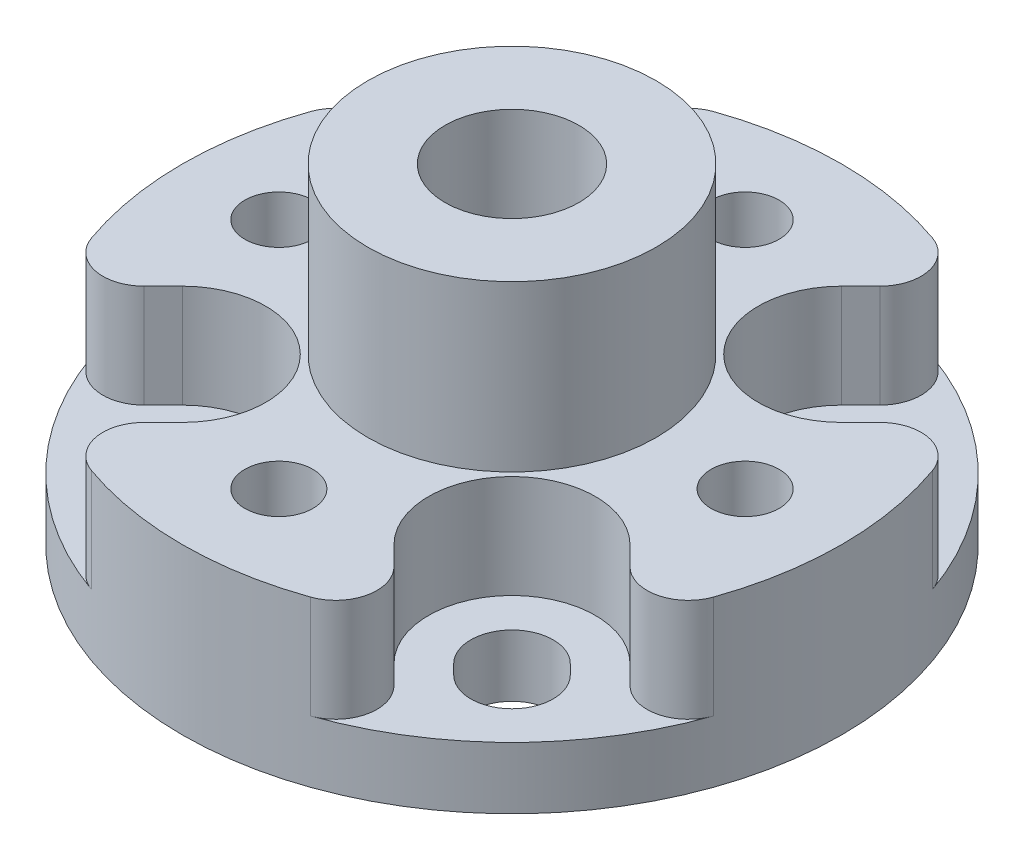
from build123d import *

# Parameters (mm, degrees)
SKETCH1_R           = 16
BOSS_EXTRUDE1_DEPTH = 8
SKETCH2_R           = 7
BOSS_EXTRUDE2_DEPTH = 8
SKETCH3_R           = 3.25
CUT_EXTRUDE1_DEPTH  = 28.712812921
SKETCH4_R           = 1.65
CUT_EXTRUDE2_DEPTH  = 25
CUT_EXTRUDE3_DEPTH  = 25
CUT_EXTRUDE4_START  = -5
CUT_EXTRUDE4_DEPTH  = 5


with BuildPart() as part:
    # Sketch1 → Boss-Extrude1 (new body)
    with BuildSketch(Plane(origin=(0, 0, 0), x_dir=(1, 0, 0), z_dir=(0, 1, 0))):
        with Locations(Location((0, 0, 0), (0, 0, 270))):
            Circle(SKETCH1_R)
    extrude(amount=BOSS_EXTRUDE1_DEPTH)

    # Sketch2 → Boss-Extrude2 (add)
    with BuildSketch(Plane(origin=(0, 8, 0), x_dir=(1, 0, 0), z_dir=(0, 1, 0))):
        with Locations(Location((0, 0, 0), (0, 0, 270))):
            Circle(SKETCH2_R)
    extrude(amount=BOSS_EXTRUDE2_DEPTH)

    # Sketch3 → Cut-Extrude1 (cut, through all)
    with BuildSketch(Plane(origin=(0, 16, 0), x_dir=(1, 0, 0), z_dir=(0, 1, 0))):
        with Locations(Location((0, 0, 0), (0, 0, 270))):
            Circle(SKETCH3_R)
    extrude(amount=-CUT_EXTRUDE1_DEPTH, mode=Mode.SUBTRACT)

    # Sketch4 → Cut-Extrude2 (cut, through all)
    with BuildSketch(Plane(origin=(0, 8, 0), x_dir=(1, 0, 0), z_dir=(0, 1, 0))):
        with Locations(Location((0, 11.313708499, 0), (0, 0, 270))):
            Circle(SKETCH4_R)
        with Locations(Location((-11.313708499, 0, 0), (0, 0, 270))):
            Circle(SKETCH4_R)
        with Locations(Location((0, -11.313708499, 0), (0, 0, 270))):
            Circle(SKETCH4_R)
        with Locations(Location((11.313708499, 0, 0), (0, 0, 270))):
            Circle(SKETCH4_R)
    extrude(amount=-CUT_EXTRUDE2_DEPTH, mode=Mode.SUBTRACT)

    # Sketch5 → Cut-Extrude3 (cut, through all)
    with BuildSketch(Plane(origin=(0, 8, 0), x_dir=(1, 0, 0), z_dir=(0, 1, 0))):
        with BuildLine():
            Line((-9.414213562, 6.585786438), (-9.899494937, 7.071067812))
            ThreePointArc((-9.899494937, 7.071067812), (-9.899494937, 9.899494937), (-7.071067812, 9.899494937))
            Line((-7.071067812, 9.899494937), (-6.585786438, 9.414213562))
            ThreePointArc((-6.585786438, 9.414213562), (-6.585786438, 6.585786438), (-9.414213562, 6.585786438))
        make_face()
        with BuildLine():
            Line((6.585786438, -9.414213562), (7.071067812, -9.899494937))
            ThreePointArc((7.071067812, -9.899494937), (9.899494937, -9.899494937), (9.899494937, -7.071067812))
            Line((9.899494937, -7.071067812), (9.414213562, -6.585786438))
            ThreePointArc((9.414213562, -6.585786438), (6.585786438, -6.585786438), (6.585786438, -9.414213562))
        make_face()
        with BuildLine():
            Line((6.585786438, 9.414213562), (7.071067812, 9.899494937))
            ThreePointArc((7.071067812, 9.899494937), (9.899494937, 9.899494937), (9.899494937, 7.071067812))
            Line((9.899494937, 7.071067812), (9.414213562, 6.585786438))
            ThreePointArc((9.414213562, 6.585786438), (6.585786438, 6.585786438), (6.585786438, 9.414213562))
        make_face()
        with BuildLine():
            Line((-9.414213562, -6.585786438), (-9.899494937, -7.071067812))
            ThreePointArc((-9.899494937, -7.071067812), (-9.899494937, -9.899494937), (-7.071067812, -9.899494937))
            Line((-7.071067812, -9.899494937), (-6.585786438, -9.414213562))
            ThreePointArc((-6.585786438, -9.414213562), (-6.585786438, -6.585786438), (-9.414213562, -6.585786438))
        make_face()
    extrude(amount=-CUT_EXTRUDE3_DEPTH, mode=Mode.SUBTRACT)

    # Sketch6 → Cut-Extrude4 (cut)
    with BuildSketch(Plane(origin=(0, 8, 0), x_dir=(1, 0, 0), z_dir=(0, 1, 0)).offset(CUT_EXTRUDE4_START)):
        with BuildLine():
            Line((-10.863782464, 5.136217536), (-11.791198103, 6.063633176))
            ThreePointArc((-11.791198103, 6.063633176), (-13.648570413, 6.599704291), (-15.091899046, 5.313622415))
            ThreePointArc((-15.091899046, 5.313622415), (-11.313708499, 11.313708499), (-5.313622415, 15.091899046))
            ThreePointArc((-5.313622415, 15.091899046), (-6.599704291, 13.648570413), (-6.063633176, 11.791198103))
            Line((-6.063633176, 11.791198103), (-5.136217536, 10.863782464))
            ThreePointArc((-5.136217536, 10.863782464), (-5.136217536, 5.136217536), (-10.863782464, 5.136217536))
        make_face()
        with BuildLine():
            Line((5.136217536, 10.863782464), (6.063633176, 11.791198103))
            ThreePointArc((6.063633176, 11.791198103), (6.599704291, 13.648570413), (5.313622415, 15.091899046))
            ThreePointArc((5.313622415, 15.091899046), (11.313708499, 11.313708499), (15.091899046, 5.313622415))
            ThreePointArc((15.091899046, 5.313622415), (13.648570413, 6.599704291), (11.791198103, 6.063633176))
            Line((11.791198103, 6.063633176), (10.863782464, 5.136217536))
            ThreePointArc((10.863782464, 5.136217536), (5.136217536, 5.136217536), (5.136217536, 10.863782464))
        make_face()
        with BuildLine():
            Line((10.863782464, -5.136217536), (11.791198103, -6.063633176))
            ThreePointArc((11.791198103, -6.063633176), (13.648570413, -6.599704291), (15.091899046, -5.313622415))
            ThreePointArc((15.091899046, -5.313622415), (11.313708499, -11.313708499), (5.313622415, -15.091899046))
            ThreePointArc((5.313622415, -15.091899046), (6.599704291, -13.648570413), (6.063633176, -11.791198103))
            Line((6.063633176, -11.791198103), (5.136217536, -10.863782464))
            ThreePointArc((5.136217536, -10.863782464), (5.136217536, -5.136217536), (10.863782464, -5.136217536))
        make_face()
        with BuildLine():
            Line((-5.136217536, -10.863782464), (-6.063633176, -11.791198103))
            ThreePointArc((-6.063633176, -11.791198103), (-6.599704291, -13.648570413), (-5.313622415, -15.091899046))
            ThreePointArc((-5.313622415, -15.091899046), (-11.313708499, -11.313708499), (-15.091899046, -5.313622415))
            ThreePointArc((-15.091899046, -5.313622415), (-13.648570413, -6.599704291), (-11.791198103, -6.063633176))
            Line((-11.791198103, -6.063633176), (-10.863782464, -5.136217536))
            ThreePointArc((-10.863782464, -5.136217536), (-5.136217536, -5.136217536), (-5.136217536, -10.863782464))
        make_face()
    extrude(amount=CUT_EXTRUDE4_DEPTH, mode=Mode.SUBTRACT)


solid = part.part
